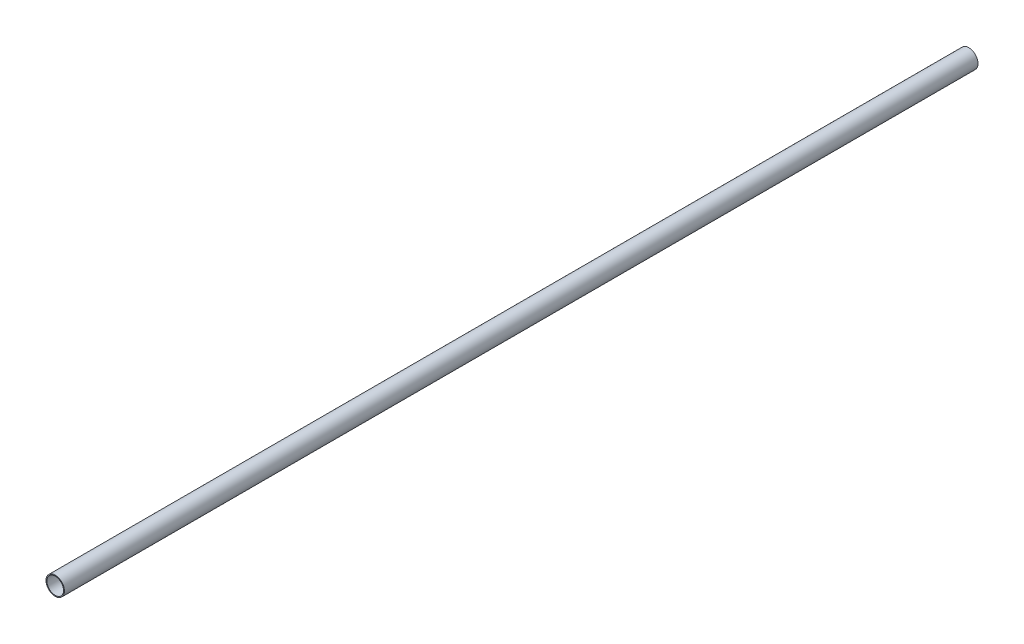
from build123d import *

# Parameters (mm, degrees)
SKETCH1_R      = 25.4
SKETCH1_R_2    = 22.987
EXTRUDE1_DEPTH = 1259.7003


with BuildPart() as part:
    # Sketch1 → Extrude1 (new, symmetric)
    with BuildSketch(Plane.XY):
        Circle(SKETCH1_R)
        Circle(SKETCH1_R_2, mode=Mode.SUBTRACT)
    extrude(amount=EXTRUDE1_DEPTH, both=True)


solid = part.part
